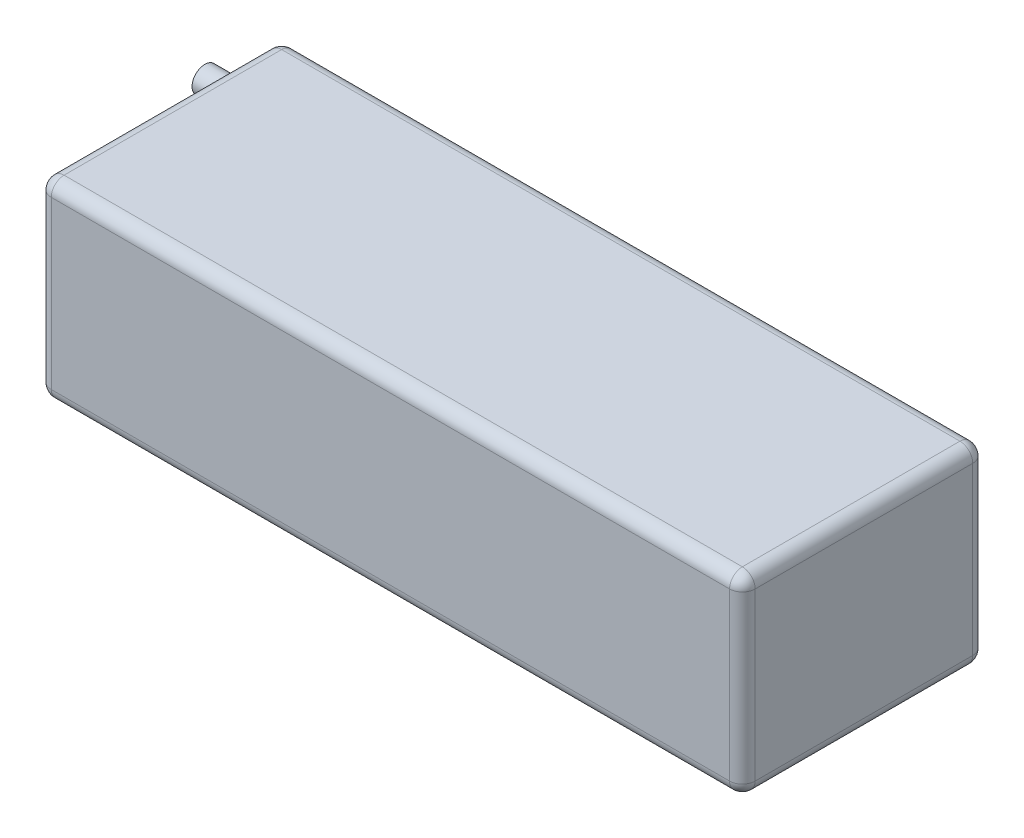
from build123d import *

# Parameters (mm, degrees)
SKETCH1_W           = 110
SKETCH1_H           = 38
BOSS_EXTRUDE1_DEPTH = 30
FILLET1_R           = 2
SKETCH2_R           = 2
BOSS_EXTRUDE2_DEPTH = 10


with BuildPart() as part:
    # Sketch1 → Boss-Extrude1 (new body)
    with BuildSketch(Plane(origin=(0, 0, 0), x_dir=(1, 0, 0), z_dir=(0, 1, 0))):
        Rectangle(SKETCH1_W, SKETCH1_H)
    extrude(amount=BOSS_EXTRUDE1_DEPTH)

    # Fillet1
    fillet1_edges = [part.edges().sort_by_distance(p)[0] for p in [
        (55, 30, 0),
        (0, 30, -19),
        (-55, 30, 0),
        (0, 0, -19),
        (55, 0, 0),
        (0, 0, 19),
        (-55, 0, 0),
        (0, 30, 19),
        (-55, 15, -19),
        (55, 15, -19),
        (55, 15, 19),
        (-55, 15, 19),
    ]]
    fillet(fillet1_edges, radius=FILLET1_R)

    # Sketch2 → Boss-Extrude2 (add, symmetric)
    with BuildSketch(Plane.ZY.offset(55)):
        with Locations(Location((-17, 20, 0), (0, 0, 180))):
            Circle(SKETCH2_R)
        with Locations(Location((-17, 15, 0), (0, 0, 180))):
            Circle(SKETCH2_R)
        with Locations(Location((-17, 10, 0), (0, 0, 180))):
            Circle(SKETCH2_R)
    extrude(amount=BOSS_EXTRUDE2_DEPTH, both=True)


solid = part.part
